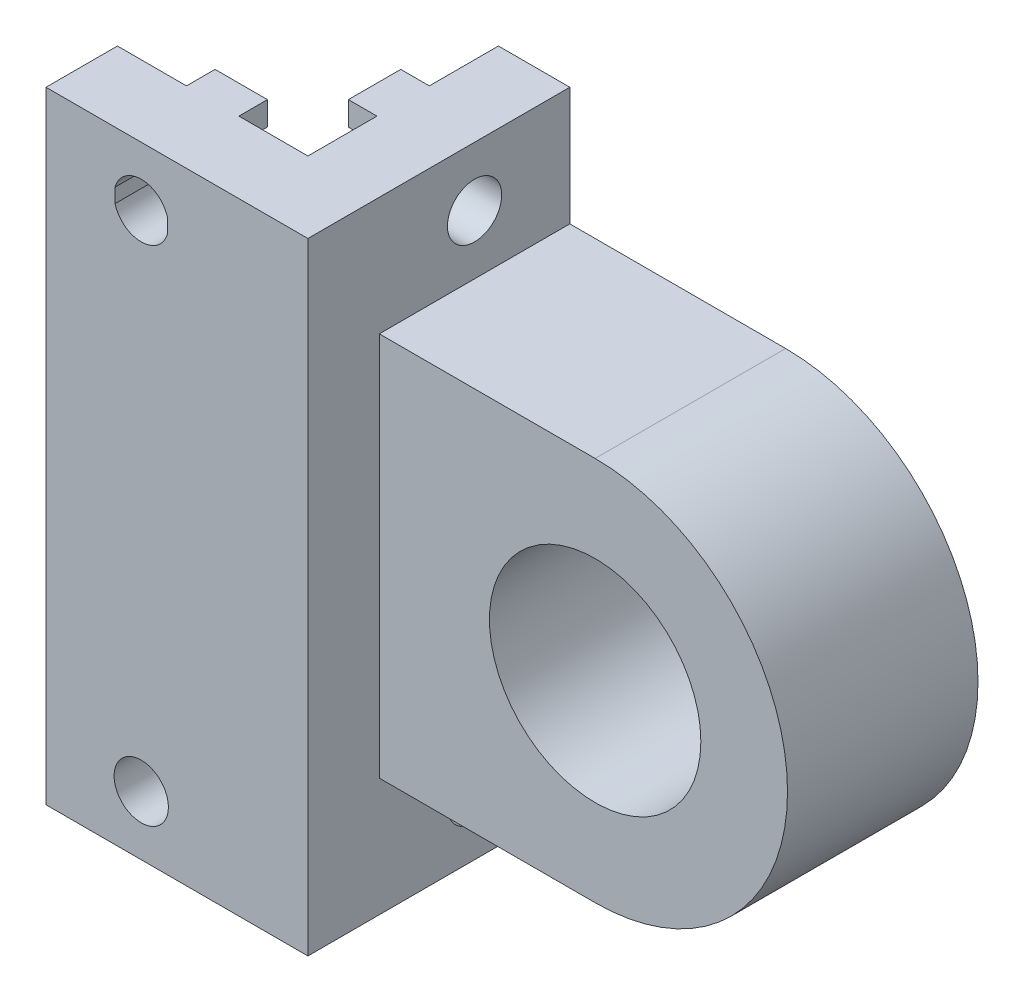
from build123d import *

# Parameters (mm, degrees)
SKETCH_2_R          = 11.1
EXTRUDE_4_DEPTH     = 20
CUT_EXTRUDE_1_DEPTH = 10
EXTRUDE_5_DEPTH     = 3
EXTRUDE_6_DEPTH     = 7.5
SKETCH_19_R         = 2.85
CUT_EXTRUDE_2_DEPTH = 10
EXTRUDE_7_DEPTH     = 3


with BuildPart() as part:
    # Эскиз2 → Бобышка-Вытянуть4 (new body)
    with BuildSketch(Plane.XY):
        with BuildLine():
            Line((0, 20.2), (-22.659630228, 20.2))
            Line((-22.659630228, 20.2), (-22.659630228, 32.623416793))
            Line((-22.659630228, 32.623416793), (-30.159630228, 32.623416793))
            Line((-30.159630228, 32.623416793), (-30.159630228, -32.623416793))
            Line((-30.159630228, -32.623416793), (-22.659630228, -32.623416793))
            Line((-22.659630228, -32.623416793), (-22.659630228, -20.2))
            Line((-22.659630228, -20.2), (0, -20.2))
            ThreePointArc((0, -20.2), (20.2, 0), (0, 20.2))
        make_face()
        Circle(SKETCH_2_R, mode=Mode.SUBTRACT)
    extrude(amount=EXTRUDE_4_DEPTH)

    # Эскиз8 → Вырез-Вытянуть1 (cut)
    with BuildSketch(Plane(origin=(-22.659630228, 0, 0), x_dir=(0, 0, -1), z_dir=(1, 0, 0))):
        with BuildLine():
            ThreePointArc((-10, -23.561708397), (-12.85, -26.411708397), (-10, -29.261708397))
            Line((-10, -29.261708397), (-10, -23.561708397))
        make_face()
        with BuildLine():
            Line((-10, -23.561708397), (-10, -29.261708397))
            ThreePointArc((-10, -29.261708397), (-7.984745674, -28.426962723), (-7.15, -26.411708397))
            ThreePointArc((-7.15, -26.411708397), (-7.984745674, -24.39645407), (-10, -23.561708397))
        make_face()
        with BuildLine():
            ThreePointArc((-7.15, 26.411708397), (-7.984745674, 28.426962723), (-10, 29.261708397))
            Line((-10, 29.261708397), (-10, 23.561708397))
            ThreePointArc((-10, 23.561708397), (-7.984745674, 24.39645407), (-7.15, 26.411708397))
        make_face()
        with BuildLine():
            Line((-10, 23.561708397), (-10, 29.261708397))
            ThreePointArc((-10, 29.261708397), (-12.85, 26.411708397), (-10, 23.561708397))
        make_face()
    extrude(amount=-CUT_EXTRUDE_1_DEPTH, mode=Mode.SUBTRACT)

    # Эскиз15 → Бобышка-Вытянуть5 (add)
    with BuildSketch(Plane.ZY.offset(30.159630228)):
        Polygon((7.25, 22.701708397), (10, 22.701708397), (12.75, 22.701708397), (12.75, -22.701708397), (7.25, -22.701708397), align=None)
        Polygon((7.25, 32.623416793), (7.25, 30.121708397), (10, 30.121708397), (12.75, 30.121708397), (12.75, 32.623416793), align=None)
        Polygon((10, -30.121708397), (7.756029521, -30.121708397), (7.25, -30.121708397), (7.25, -32.623416793), (12.75, -32.623416793), (12.75, -30.121708397), align=None)
    extrude(amount=EXTRUDE_5_DEPTH)

    # Эскиз18 → Бобышка-Вытянуть6 (add)
    with BuildSketch(Plane.XY.offset(20)):
        Polygon((-30.159630228, -32.623416793), (-50.159630228, -32.623416793), (-50.159630228, 32.623416793), (-30.159630228, 32.623416793), (-22.659630228, 32.623416793), (-22.659630228, -32.623416793), align=None)
    extrude(amount=EXTRUDE_6_DEPTH)

    # Эскиз19 → Вырез-Вытянуть2 (cut)
    with BuildSketch(Plane(origin=(0, 0, 20), x_dir=(-1, 0, 0), z_dir=(0, 0, -1))):
        with Locations((40.159630228, -26.413416793)):
            Circle(SKETCH_19_R)
        with BuildLine():
            Line((37.409630228, 27.161748271), (37.409630228, 25.665085316))
            ThreePointArc((37.409630228, 25.665085316), (40.159630228, 23.563416793), (42.909630228, 25.665085316))
            Line((42.909630228, 25.665085316), (42.909630228, 27.161748271))
            ThreePointArc((42.909630228, 27.161748271), (40.159630228, 29.263416793), (37.409630228, 27.161748271))
        make_face()
    extrude(amount=-CUT_EXTRUDE_2_DEPTH, mode=Mode.SUBTRACT)

    # Эскиз19<14> → Бобышка-Вытянуть7 (add)
    with BuildSketch(Plane(origin=(0, 0, 20), x_dir=(-1, 0, 0), z_dir=(0, 0, -1))):
        Polygon((37.409630228, -22.703416793), (40.159630228, -22.703416793), (42.909630228, -22.703416793), (42.909630228, 22.703416793), (40.159630228, 22.703416793), (37.409630228, 22.703416793), align=None)
        Polygon((37.409630228, 32.623416793), (37.409630228, 30.123416793), (40.159630228, 30.123416793), (42.909630228, 30.123416793), (42.909630228, 32.623416793), align=None)
        Polygon((42.909630228, -30.123416793), (40.159630228, -30.123416793), (37.409630228, -30.123416793), (37.409630228, -32.623416793), (42.909630228, -32.623416793), align=None)
    extrude(amount=EXTRUDE_7_DEPTH)


solid = part.part
